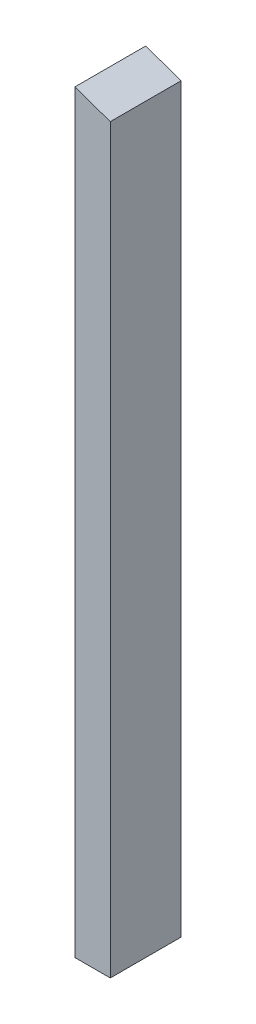
from build123d import *

# Parameters (mm, degrees)
SKETCH_1_W          = 25
SKETCH_1_H          = 50
EXTRUDE_1_DEPTH     = 550
SKETCH_2_R          = 4
CUT_EXTRUDE_1_DEPTH = 10
CUT_EXTRUDE_START   = -10
SKETCH_3_R          = 4
CUT_EXTRUDE_2_DEPTH = 10
CUT_EXTRUDE_4_DEPTH = 550


with BuildPart() as part:
    # Эскиз1 → Бобышка-Вытянуть1 (new body)
    with BuildSketch(Plane(origin=(0, 0, 0), x_dir=(1, 0, 0), z_dir=(0, 1, 0))):
        Rectangle(SKETCH_1_W, SKETCH_1_H)
    extrude(amount=EXTRUDE_1_DEPTH)

    # Эскиз2 → Вырез-Вытянуть1 (cut)
    with BuildSketch(Plane(origin=(0, 550, 0), x_dir=(1, 0, 0), z_dir=(0, 1, 0))):
        with Locations(Location((0, 0, 0), (0, 0, 270))):
            Circle(SKETCH_2_R)
    extrude(amount=-CUT_EXTRUDE_1_DEPTH, mode=Mode.SUBTRACT)

    # Эскиз3 → Вырез-Вытянуть2 (cut)
    with BuildSketch(Plane.XZ.offset(CUT_EXTRUDE_START)):
        with Locations(Location((0, 0, 0), (0, 0, 90))):
            Circle(SKETCH_3_R)
    extrude(amount=CUT_EXTRUDE_2_DEPTH, mode=Mode.SUBTRACT)

    # Эскиз4 → Вырез-Вытянуть4 (cut)
    with BuildSketch(Plane.XY.offset(25)):
        Polygon((12.5, 550), (12.5, 523.51952282), (-12.5, 532.24968156), (-12.5, 550), align=None)
    extrude(amount=-CUT_EXTRUDE_4_DEPTH, mode=Mode.SUBTRACT)


solid = part.part
